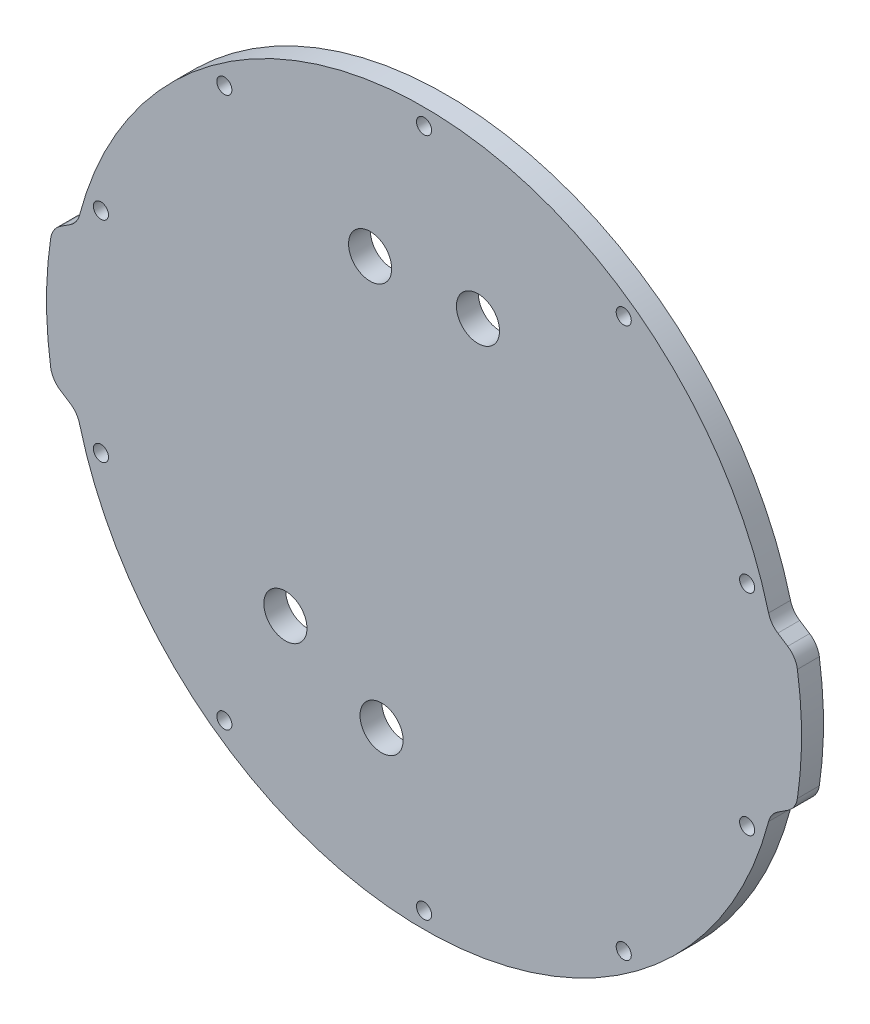
from build123d import *

# Parameters (mm, degrees)
SKETCH1_R           = 1.75
SKETCH1_R_2         = 5
BOSS_EXTRUDE1_DEPTH = 2.54
FILLET1_R           = 5.08


with BuildPart() as part:
    # Sketch1 → Boss-Extrude1 (new, symmetric)
    with BuildSketch(Plane.XY):
        with BuildLine():
            Line((-86.162592811, 15.24), (-80.321852568, 19.05))
            ThreePointArc((-80.321852568, 19.05), (0, 82.55), (80.321852568, 19.05))
            Line((80.321852568, 19.05), (86.162592811, 15.24))
            ThreePointArc((86.162592811, 15.24), (87.5, 0), (86.162592811, -15.24))
            Line((86.162592811, -15.24), (80.321852568, -19.05))
            ThreePointArc((80.321852568, -19.05), (0, -82.55), (-80.321852568, -19.05))
            Line((-80.321852568, -19.05), (-86.162592811, -15.24))
            ThreePointArc((-86.162592811, -15.24), (-87.5, 0), (-86.162592811, 15.24))
        make_face()
        with Locations((0, 78.74)):
            Circle(SKETCH1_R, mode=Mode.SUBTRACT)
        with Locations((46.282210766, 63.701998137)):
            Circle(SKETCH1_R, mode=Mode.SUBTRACT)
        with Locations((74.886190093, 24.331998137)):
            Circle(SKETCH1_R, mode=Mode.SUBTRACT)
        with Locations((74.886190093, -24.331998137)):
            Circle(SKETCH1_R, mode=Mode.SUBTRACT)
        with Locations((46.282210766, -63.701998137)):
            Circle(SKETCH1_R, mode=Mode.SUBTRACT)
        with Locations((0, -78.74)):
            Circle(SKETCH1_R, mode=Mode.SUBTRACT)
        with Locations((-46.282210766, -63.701998137)):
            Circle(SKETCH1_R, mode=Mode.SUBTRACT)
        with Locations((-74.886190093, -24.331998137)):
            Circle(SKETCH1_R, mode=Mode.SUBTRACT)
        with Locations((-74.886190093, 24.331998137)):
            Circle(SKETCH1_R, mode=Mode.SUBTRACT)
        with Locations((-46.282210766, 63.701998137)):
            Circle(SKETCH1_R, mode=Mode.SUBTRACT)
        with Locations((-32.134671235, -35.656176248)):
            Circle(SKETCH1_R_2, mode=Mode.SUBTRACT)
        with Locations((-9.845967479, -46.979324435)):
            Circle(SKETCH1_R_2, mode=Mode.SUBTRACT)
        with Locations((-12.5, 46.343823752)):
            Circle(SKETCH1_R_2, mode=Mode.SUBTRACT)
        with Locations((12.5, 46.343823752)):
            Circle(SKETCH1_R_2, mode=Mode.SUBTRACT)
    extrude(amount=BOSS_EXTRUDE1_DEPTH, both=True)

    # Fillet1
    fillet1_edges = [part.edges().sort_by_distance(p)[0] for p in [
        (-86.162592811, 15.24, 0),
        (-80.321852568, 19.05, 0),
        (80.321852568, 19.05, 0),
        (86.162592811, 15.24, 0),
        (86.162592811, -15.24, 0),
        (80.321852568, -19.05, 0),
        (-80.321852568, -19.05, 0),
        (-86.162592811, -15.24, 0),
    ]]
    fillet(fillet1_edges, radius=FILLET1_R)


solid = part.part
